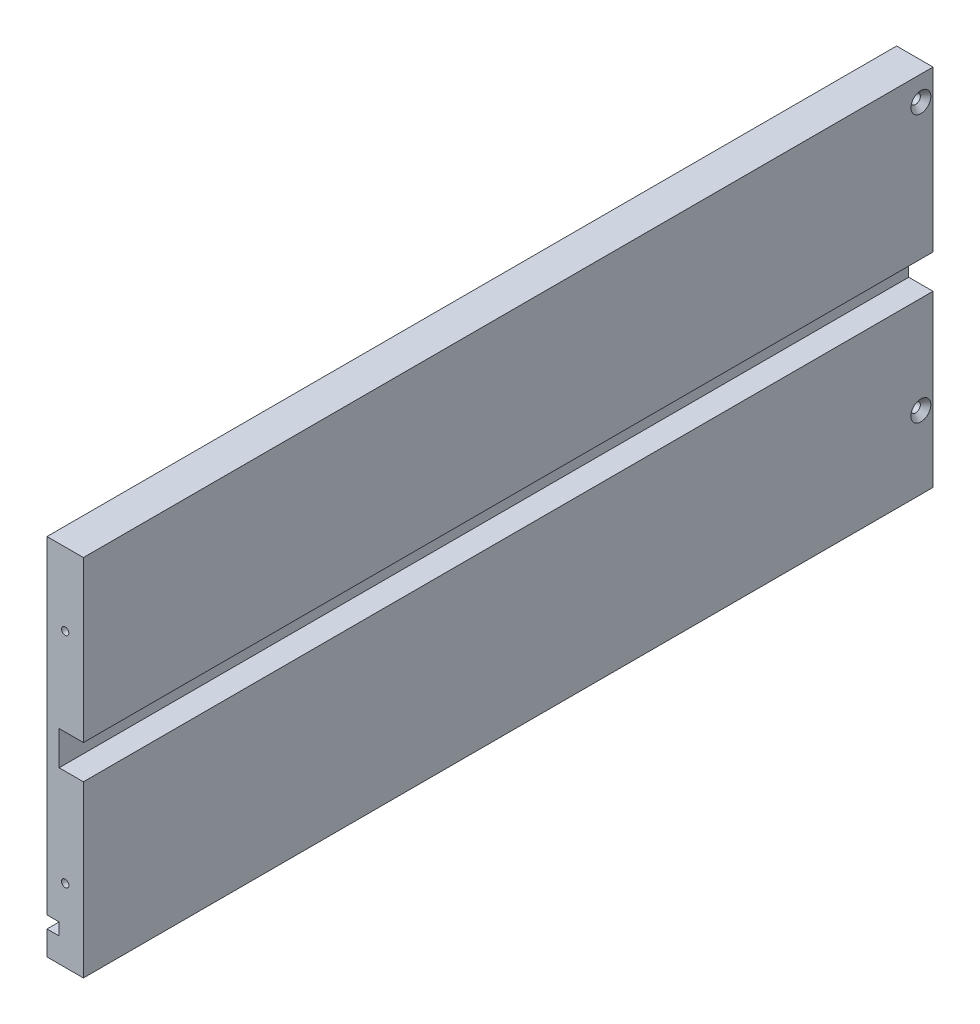
from build123d import *

# Parameters (mm, degrees)
SKETCH2_W                                         = 350
SKETCH2_H                                         = 150
BASE_EXTRUDE_DEPTH                                = 15
SKETCH3_W                                         = 10
SKETCH3_H                                         = 14
CUT_EXTRUDE1_DEPTH                                = 382.083980246
SKETCH4_W                                         = 5
SKETCH4_H                                         = 5
CUT_EXTRUDE2_DEPTH                                = 382.083980246
CSK_FOR_M3_5_FLAT_HEAD_MACHINE_SCREW1_D           = 3.9
CSK_FOR_M3_5_FLAT_HEAD_MACHINE_SCREW1_CSINK_D     = 8.2
CSK_FOR_M3_5_FLAT_HEAD_MACHINE_SCREW1_CSINK_ANGLE = 90
M3_0_3_000000_DIAMETER_HOLE1_D                    = 3
M3_0_3_000000_DIAMETER_HOLE1_DEPTH                = 10
M3_0_3_000000_DIAMETER_HOLE1_TIP                  = 0.901290929


with BuildPart() as part:
    # Sketch2 → Base-Extrude (new body)
    with BuildSketch(Plane(origin=(0, 0, 0), x_dir=(0, 0, -1), z_dir=(1, 0, 0))):
        with Locations((175, 75)):
            Rectangle(SKETCH2_W, SKETCH2_H)
    extrude(amount=-BASE_EXTRUDE_DEPTH)

    # Sketch3 → Cut-Extrude1 (cut, through all)
    with BuildSketch(Plane.XY):
        with Locations((-5, 77)):
            Rectangle(SKETCH3_W, SKETCH3_H)
    extrude(amount=-CUT_EXTRUDE1_DEPTH, mode=Mode.SUBTRACT)

    # Sketch4 → Cut-Extrude2 (cut, through all)
    with BuildSketch(Plane.XY):
        with Locations((-12.5, 12.5)):
            Rectangle(SKETCH4_W, SKETCH4_H)
    extrude(amount=-CUT_EXTRUDE2_DEPTH, mode=Mode.SUBTRACT)

    # CSK for M3.5 Flat Head Machine Screw1 (through all)
    with Locations(Plane(origin=(0, 0, 0), x_dir=(0, 0, -1), z_dir=(1, 0, 0))):
        with Locations((345, 140), (345, 30)):
            CounterSinkHole(CSK_FOR_M3_5_FLAT_HEAD_MACHINE_SCREW1_D / 2, CSK_FOR_M3_5_FLAT_HEAD_MACHINE_SCREW1_CSINK_D / 2, counter_sink_angle=CSK_FOR_M3_5_FLAT_HEAD_MACHINE_SCREW1_CSINK_ANGLE)

    # M3.0 (3.000000) Diameter Hole1
    with Locations(Plane.XY):
        with Locations((-7.5, 30), (-7.5, 120)):
            Hole(M3_0_3_000000_DIAMETER_HOLE1_D / 2, depth=M3_0_3_000000_DIAMETER_HOLE1_DEPTH)
            with Locations((0, 0, -(M3_0_3_000000_DIAMETER_HOLE1_DEPTH + M3_0_3_000000_DIAMETER_HOLE1_TIP / 2))):  # 118° drill point
                Cone(0, M3_0_3_000000_DIAMETER_HOLE1_D / 2, M3_0_3_000000_DIAMETER_HOLE1_TIP, mode=Mode.SUBTRACT)


solid = part.part
